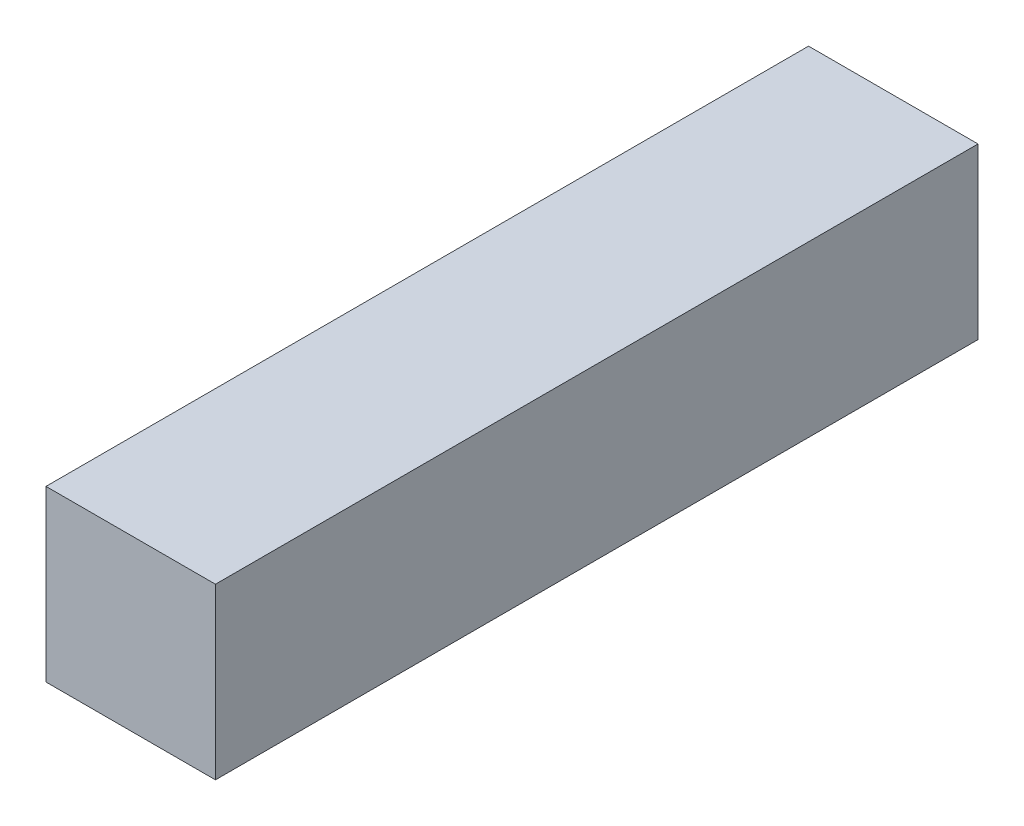
from build123d import *

# Parameters (mm, degrees)
SKETCH1_W           = 25.4
SKETCH1_H           = 25.4
BOSS_EXTRUDE1_DEPTH = 114.3


with BuildPart() as part:
    # Sketch1 → Boss-Extrude1 (new body)
    with BuildSketch(Plane.XY):
        with Locations((12.7, 12.7)):
            Rectangle(SKETCH1_W, SKETCH1_H)
    extrude(amount=BOSS_EXTRUDE1_DEPTH)


solid = part.part
